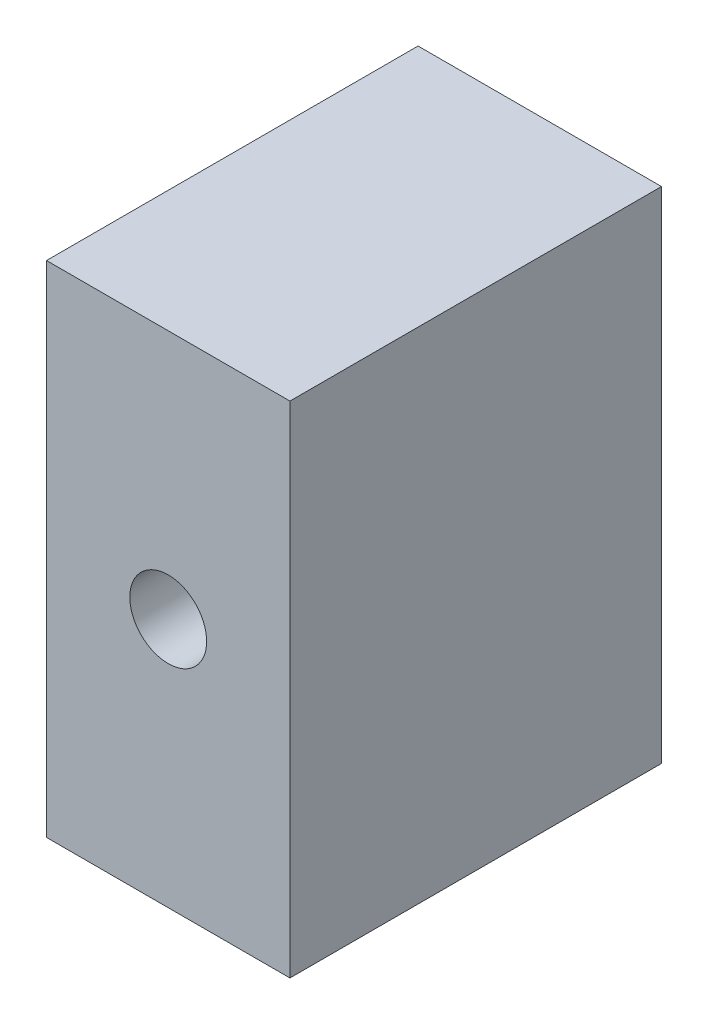
from build123d import *

# Parameters (mm, degrees)
ESQUISSE1_W        = 19
ESQUISSE1_H        = 39
ESQUISSE1_R        = 3
BOSS_EXTRU_1_DEPTH = 29


with BuildPart() as part:
    # Esquisse1 → Boss.-Extru.1 (new body)
    with BuildSketch(Plane.XY):
        with Locations((9.5, 19.5)):
            Rectangle(ESQUISSE1_W, ESQUISSE1_H)
        with Locations(Location((9.5, 19.5, 0), (0, 0, 180))):
            Circle(ESQUISSE1_R, mode=Mode.SUBTRACT)
    extrude(amount=BOSS_EXTRU_1_DEPTH)


solid = part.part
